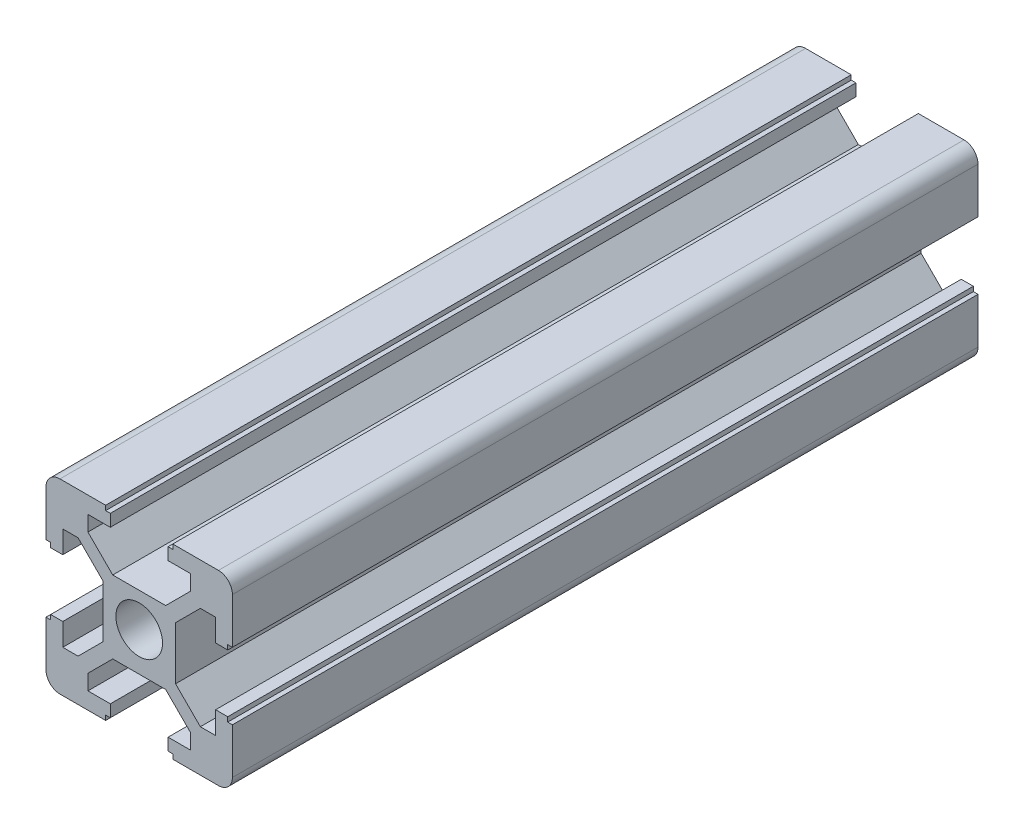
from build123d import *

# Parameters (mm, degrees)
SKETCH1_R           = 2.5
BOSS_EXTRUDE1_DEPTH = 80


with BuildPart() as part:
    # Sketch1 → Boss-Extrude1 (new body)
    with BuildSketch(Plane.XY):
        with BuildLine():
            Line((2.839339828, 3.9), (5.5, 6.560660172))
            Line((5.5, 6.560660172), (5.5, 8.2))
            Line((5.5, 8.2), (3.1, 8.2))
            Line((3.1, 8.2), (3.1, 9.5))
            Line((3.1, 9.5), (3.6, 9.5))
            Line((3.6, 9.5), (3.6, 10))
            Line((3.6, 10), (8.5, 10))
            ThreePointArc((8.5, 10), (9.560660172, 9.560660172), (10, 8.5))
            Line((10, 8.5), (10, 3.6))
            Line((10, 3.6), (9.5, 3.6))
            Line((9.5, 3.6), (9.5, 3.1))
            Line((9.5, 3.1), (8.2, 3.1))
            Line((8.2, 3.1), (8.2, 5.5))
            Line((8.2, 5.5), (6.560660172, 5.5))
            Line((6.560660172, 5.5), (3.9, 2.839339828))
            Line((3.9, 2.839339828), (3.9, -2.839339828))
            Line((3.9, -2.839339828), (6.560660172, -5.5))
            Line((6.560660172, -5.5), (8.2, -5.5))
            Line((8.2, -5.5), (8.2, -3.1))
            Line((8.2, -3.1), (9.5, -3.1))
            Line((9.5, -3.1), (9.5, -3.6))
            Line((9.5, -3.6), (10, -3.6))
            Line((10, -3.6), (10, -8.5))
            ThreePointArc((10, -8.5), (9.560660172, -9.560660172), (8.5, -10))
            Line((8.5, -10), (3.6, -10))
            Line((3.6, -10), (3.6, -9.5))
            Line((3.6, -9.5), (3.1, -9.5))
            Line((3.1, -9.5), (3.1, -8.2))
            Line((3.1, -8.2), (5.5, -8.2))
            Line((5.5, -8.2), (5.5, -6.560660172))
            Line((5.5, -6.560660172), (2.839339828, -3.9))
            Line((2.839339828, -3.9), (-2.839339828, -3.9))
            Line((-2.839339828, -3.9), (-5.5, -6.560660172))
            Line((-5.5, -6.560660172), (-5.5, -8.2))
            Line((-5.5, -8.2), (-3.1, -8.2))
            Line((-3.1, -8.2), (-3.1, -9.5))
            Line((-3.1, -9.5), (-3.6, -9.5))
            Line((-3.6, -9.5), (-3.6, -10))
            Line((-3.6, -10), (-8.5, -10))
            ThreePointArc((-8.5, -10), (-9.560660172, -9.560660172), (-10, -8.5))
            Line((-10, -8.5), (-10, -3.6))
            Line((-10, -3.6), (-9.5, -3.6))
            Line((-9.5, -3.6), (-9.5, -3.1))
            Line((-9.5, -3.1), (-8.2, -3.1))
            Line((-8.2, -3.1), (-8.2, -5.5))
            Line((-8.2, -5.5), (-6.560660172, -5.5))
            Line((-6.560660172, -5.5), (-3.9, -2.839339828))
            Line((-3.9, -2.839339828), (-3.9, 2.839339828))
            Line((-3.9, 2.839339828), (-6.560660172, 5.5))
            Line((-6.560660172, 5.5), (-8.2, 5.5))
            Line((-8.2, 5.5), (-8.2, 3.1))
            Line((-8.2, 3.1), (-9.5, 3.1))
            Line((-9.5, 3.1), (-9.5, 3.6))
            Line((-9.5, 3.6), (-10, 3.6))
            Line((-10, 3.6), (-10, 8.5))
            ThreePointArc((-10, 8.5), (-9.560660172, 9.560660172), (-8.5, 10))
            Line((-8.5, 10), (-3.6, 10))
            Line((-3.6, 10), (-3.6, 9.5))
            Line((-3.6, 9.5), (-3.1, 9.5))
            Line((-3.1, 9.5), (-3.1, 8.2))
            Line((-3.1, 8.2), (-5.5, 8.2))
            Line((-5.5, 8.2), (-5.5, 6.560660172))
            Line((-5.5, 6.560660172), (-2.839339828, 3.9))
            Line((-2.839339828, 3.9), (2.839339828, 3.9))
        make_face()
        with Locations((0, 0.235847297)):
            Circle(SKETCH1_R, mode=Mode.SUBTRACT)
    extrude(amount=BOSS_EXTRUDE1_DEPTH)


solid = part.part
